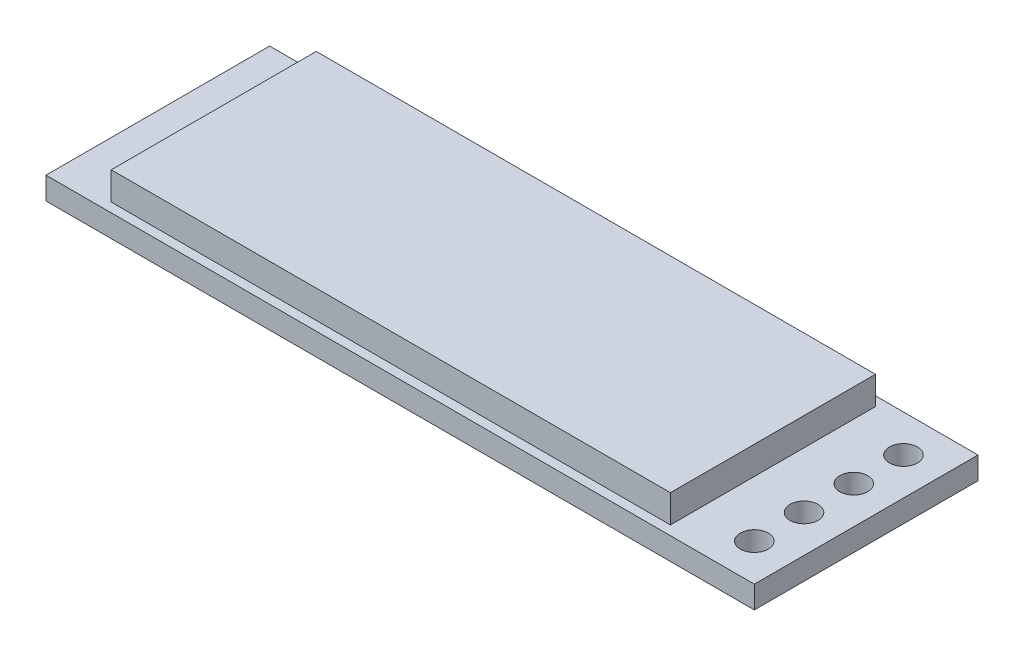
from build123d import *

# Parameters (mm, degrees)
SKETCH_1_W          = 38
SKETCH_1_H          = 12
EXTRUDE_1_DEPTH     = 1.2
SKETCH_2_W          = 30
SKETCH_2_H          = 11
EXTRUDE_2_DEPTH     = 2.7
SKETCH_3_R          = 0.75
CUT_EXTRUDE_2_DEPTH = 39.565399
EXTRUDE_START       = 1.2
SKETCH_4_W          = 2
SKETCH_4_H          = 10
SKETCH_4_H_2        = 1.370131764
EXTRUDE_3_DEPTH     = 2


with BuildPart() as part:
    # Эскиз1 → Бобышка-Вытянуть1 (new body)
    with BuildSketch(Plane(origin=(0, 0, 0), x_dir=(1, 0, 0), z_dir=(0, 1, 0))):
        with Locations((-19, 0)):
            Rectangle(SKETCH_1_W, SKETCH_1_H)
    extrude(amount=EXTRUDE_1_DEPTH)

    # Эскиз2 → Бобышка-Вытянуть2 (add)
    with BuildSketch(Plane(origin=(0, 0, 0), x_dir=(1, 0, 0), z_dir=(0, 1, 0))):
        with Locations((-20, 0)):
            Rectangle(SKETCH_2_W, SKETCH_2_H)
    extrude(amount=EXTRUDE_2_DEPTH)

    # Эскиз3 → Вырез-Вытянуть2 (cut, through all)
    with BuildSketch(Plane(origin=(0, 0, 0), x_dir=(1, 0, 0), z_dir=(0, 1, 0))):
        with Locations(Location((-2, 4, 0), (0, 0, 90))):
            Circle(SKETCH_3_R)
        with Locations(Location((-2, 1.333333333, 0), (0, 0, 90))):
            Circle(SKETCH_3_R)
        with Locations(Location((-2, -1.333333333, 0), (0, 0, 90))):
            Circle(SKETCH_3_R)
        with Locations(Location((-2, -4, 0), (0, 0, 90))):
            Circle(SKETCH_3_R)
    extrude(amount=CUT_EXTRUDE_2_DEPTH, mode=Mode.SUBTRACT)

    # Эскиз4 → Бобышка-Вытянуть3 (add)
    with BuildSketch(Plane(origin=(0, 0, 0), x_dir=(1, 0, 0), z_dir=(0, 1, 0)).offset(EXTRUDE_START)):
        with Locations((-23, 0)):
            Rectangle(SKETCH_4_W, SKETCH_4_H)
        with Locations((-16, 0)):
            Rectangle(SKETCH_4_W, SKETCH_4_H)
        with Locations((-10.327262123, 1.918184469)):
            Rectangle(SKETCH_4_W, SKETCH_4_H_2)
    extrude(amount=-EXTRUDE_3_DEPTH)


solid = part.part
